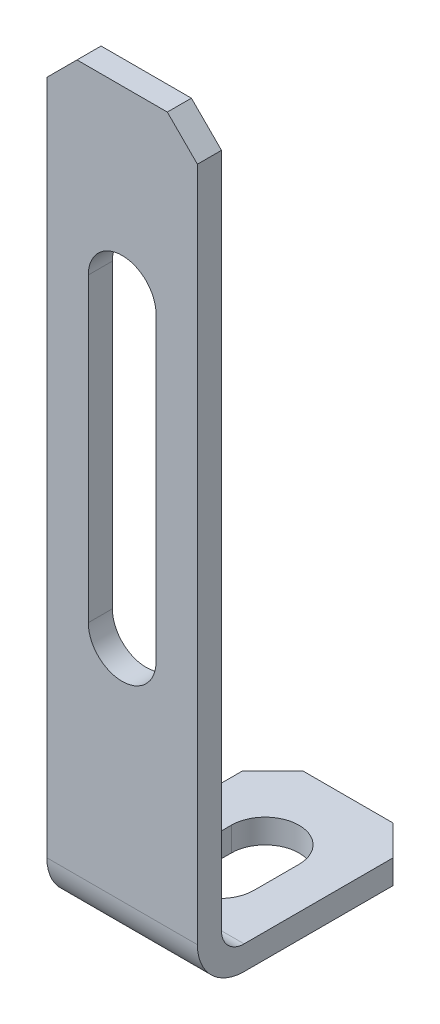
from build123d import *

# Parameters (mm, degrees)
SKETCH1_W           = 15
SKETCH1_H           = 50
BOSS_EXTRUDE1_DEPTH = 10
SKETCH2_W           = 13.4
SKETCH2_H           = 48.4
CUT_EXTRUDE1_DEPTH  = 54.150729064
CUT_EXTRUDE2_DEPTH  = 52.648426888
CUT_EXTRUDE3_DEPTH  = 54.150729064
CHAMFER1_SIZE       = 2
FILLET1_R           = 1.5
FILLET2_R           = 3.1


with BuildPart() as part:
    # Sketch1 → Boss-Extrude1 (new body)
    with BuildSketch(Plane(origin=(10, 0, 0), x_dir=(0, 0, -1), z_dir=(1, 0, 0))):
        with Locations((7.5, 25)):
            Rectangle(SKETCH1_W, SKETCH1_H)
    extrude(amount=-BOSS_EXTRUDE1_DEPTH)

    # Sketch2 → Cut-Extrude1 (cut, through all)
    with BuildSketch(Plane.ZY):
        with Locations((-8.3, 25.8)):
            Rectangle(SKETCH2_W, SKETCH2_H)
    extrude(amount=-CUT_EXTRUDE1_DEPTH, mode=Mode.SUBTRACT)

    # Sketch3 → Cut-Extrude2 (cut, through all)
    with BuildSketch(Plane(origin=(0, 1.6, 0), x_dir=(-1, 0, 0), z_dir=(0, 1, 0))):
        with BuildLine():
            Line((-2.75, -9.5), (-2.75, -6.5))
            ThreePointArc((-2.75, -6.5), (-5, -4.25), (-7.25, -6.5))
            Line((-7.25, -6.5), (-7.25, -9.5))
            ThreePointArc((-7.25, -9.5), (-5, -11.75), (-2.75, -9.5))
        make_face()
    extrude(amount=-CUT_EXTRUDE2_DEPTH, mode=Mode.SUBTRACT)

    # Sketch4 → Cut-Extrude3 (cut, through all)
    with BuildSketch(Plane.XY):
        with BuildLine():
            Line((7.25, 18), (7.25, 38))
            ThreePointArc((7.25, 38), (5, 40.25), (2.75, 38))
            Line((2.75, 38), (2.75, 18))
            ThreePointArc((2.75, 18), (5, 15.75), (7.25, 18))
        make_face()
    extrude(amount=-CUT_EXTRUDE3_DEPTH, mode=Mode.SUBTRACT)

    # Chamfer1
    chamfer1_edges = [part.edges().sort_by_distance(p)[0] for p in [
        (0, 0.8, -15),
        (10, 50, -0.8),
        (0, 50, -0.8),
        (10, 0.8, -15),
    ]]
    chamfer(chamfer1_edges, length=CHAMFER1_SIZE)

    # Fillet1
    fillet1_edges = [part.edges().sort_by_distance(p)[0] for p in [
        (5, 1.6, -1.6),
    ]]
    fillet(fillet1_edges, radius=FILLET1_R)

    # Fillet2
    fillet2_edges = [part.edges().sort_by_distance(p)[0] for p in [
        (5, 0, 0),
    ]]
    fillet(fillet2_edges, radius=FILLET2_R)


solid = part.part
